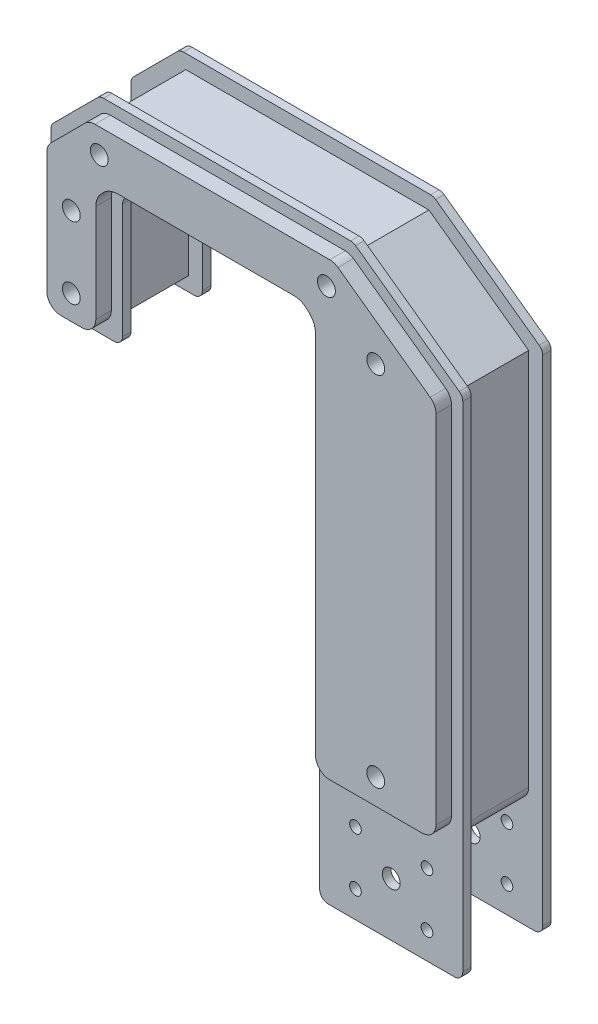
from build123d import *

# Parameters (mm, degrees)
SKETCH2_R           = 3.175
SKETCH2_R_2         = 2.07
BOSS_EXTRUDE1_DEPTH = 1.5
SKETCH3_R           = 3.175
BOSS_EXTRUDE2_DEPTH = 25.4
FILLET2_R           = 5
BOSS_EXTRUDE3_START = 26.9
SKETCH2_3_R         = 3.175
SKETCH2_3_R_2       = 2.07
BOSS_EXTRUDE3_DEPTH = 3
FILLET3_R           = 3
FILLET4_R           = 3
SKETCH5_R           = 3.175
BOSS_EXTRUDE6_DEPTH = 5.5
FILLET7_R           = 5


with BuildPart() as part:
    # Sketch2 → Boss-Extrude1 (new, symmetric)
    with BuildSketch(Plane.XY):
        Polygon((-25.4, 90), (-25.4, -90), (25.4, -90), (25.4, 90), (-13.421024484, 117.9), (-103.421024484, 117.9), (-120.8, 100.521024484), (-120.8, 45), (-95.4, 45), (-95.4, 90), (-92.9, 92.5), (-27.9, 92.5), align=None)
        with Locations((-108.1, 57.7)):
            Circle(SKETCH2_R, mode=Mode.SUBTRACT)
        with Locations((-108.1, 83.1)):
            Circle(SKETCH2_R, mode=Mode.SUBTRACT)
        with Locations((0, 90)):
            Circle(SKETCH2_R, mode=Mode.SUBTRACT)
        with Locations((0, 64.6)):
            Circle(SKETCH2_R, mode=Mode.SUBTRACT)
        with Locations((0, 39.2)):
            Circle(SKETCH2_R, mode=Mode.SUBTRACT)
        with Locations((0, 13.8)):
            Circle(SKETCH2_R, mode=Mode.SUBTRACT)
        with Locations((0, -11.6)):
            Circle(SKETCH2_R, mode=Mode.SUBTRACT)
        with Locations((0, -37)):
            Circle(SKETCH2_R, mode=Mode.SUBTRACT)
        with Locations((-57.835898506, 105.2)):
            Circle(SKETCH2_R, mode=Mode.SUBTRACT)
        with Locations((-98.160512242, 105.2)):
            Circle(SKETCH2_R, mode=Mode.SUBTRACT)
        with Locations((-17.51128477, 105.2)):
            Circle(SKETCH2_R, mode=Mode.SUBTRACT)
        with Locations((0, -70.95)):
            Circle(SKETCH2_R, mode=Mode.SUBTRACT)
        with Locations((-12.7, -61.425)):
            Circle(SKETCH2_R_2, mode=Mode.SUBTRACT)
        with Locations((12.7, -61.425)):
            Circle(SKETCH2_R_2, mode=Mode.SUBTRACT)
        with Locations((12.7, -80.475)):
            Circle(SKETCH2_R_2, mode=Mode.SUBTRACT)
        with Locations((-12.7, -80.475)):
            Circle(SKETCH2_R_2, mode=Mode.SUBTRACT)
    extrude(amount=BOSS_EXTRUDE1_DEPTH, both=True)

    # Fillet4
    fillet4_edges = [part.edges().sort_by_distance(p)[0] for p in [
        (-120.8, 100.521024484, 0),
        (-103.421024484, 117.9, 0),
        (-13.421024484, 117.9, 0),
        (25.4, 90, 0),
        (25.4, -90, 0),
        (-25.4, -90, 0),
        (-25.4, 90, 0),
        (-27.9, 92.5, 0),
        (-92.9, 92.5, 0),
        (-95.4, 90, 0),
        (-95.4, 45, 0),
        (-120.8, 45, 0),
    ]]
    fillet(fillet4_edges, radius=FILLET4_R)


with BuildPart() as body_2:
    # Sketch3 → Boss-Extrude2 (new body)
    with BuildSketch(Plane.XY.offset(1.5)):
        Polygon((-20.4, -51.9), (20.4, -51.9), (20.4, 87.436091053), (-15.031363179, 112.9), (-101.349956672, 112.9), (-115.8, 98.449956672), (-115.8, 50), (-100.4, 50), (-100.4, 92.071067812), (-94.971067812, 97.5), (-25.828932188, 97.5), (-20.4, 92.071067812), align=None)
        with Locations((0, -37)):
            Circle(SKETCH3_R, mode=Mode.SUBTRACT)
        with Locations((0, -11.6)):
            Circle(SKETCH3_R, mode=Mode.SUBTRACT)
        with Locations((0, 13.8)):
            Circle(SKETCH3_R, mode=Mode.SUBTRACT)
        with Locations((-108.1, 57.7)):
            Circle(SKETCH3_R, mode=Mode.SUBTRACT)
        with Locations((-108.1, 83.1)):
            Circle(SKETCH3_R, mode=Mode.SUBTRACT)
        with Locations((-98.160512242, 105.2)):
            Circle(SKETCH3_R, mode=Mode.SUBTRACT)
        with Locations((-57.835898506, 105.2)):
            Circle(SKETCH3_R, mode=Mode.SUBTRACT)
        with Locations((0, 39.2)):
            Circle(SKETCH3_R, mode=Mode.SUBTRACT)
        with Locations((0, 64.6)):
            Circle(SKETCH3_R, mode=Mode.SUBTRACT)
        with Locations((-17.51128477, 105.2)):
            Circle(SKETCH3_R, mode=Mode.SUBTRACT)
        with Locations((0, 90)):
            Circle(SKETCH3_R, mode=Mode.SUBTRACT)
    extrude(amount=BOSS_EXTRUDE2_DEPTH)

    # Fillet2
    fillet2_edges = [body_2.edges().sort_by_distance(p)[0] for p in [
        (20.4, -51.9, 14.2),
        (-20.4, -51.9, 14.2),
    ]]
    fillet(fillet2_edges, radius=FILLET2_R)


with BuildPart() as body_3:
    # Sketch2<3> → Boss-Extrude3 (new body)
    with BuildSketch(Plane.XY.offset(BOSS_EXTRUDE3_START)):
        Polygon((-25.4, 90), (-25.4, -90), (25.4, -90), (25.4, 90), (-13.421024484, 117.9), (-103.421024484, 117.9), (-120.8, 100.521024484), (-120.8, 45), (-95.4, 45), (-95.4, 90), (-92.9, 92.5), (-27.9, 92.5), align=None)
        with Locations((-108.1, 57.7)):
            Circle(SKETCH2_3_R, mode=Mode.SUBTRACT)
        with Locations((-108.1, 83.1)):
            Circle(SKETCH2_3_R, mode=Mode.SUBTRACT)
        with Locations((0, 90)):
            Circle(SKETCH2_3_R, mode=Mode.SUBTRACT)
        with Locations((0, 64.6)):
            Circle(SKETCH2_3_R, mode=Mode.SUBTRACT)
        with Locations((0, 39.2)):
            Circle(SKETCH2_3_R, mode=Mode.SUBTRACT)
        with Locations((0, 13.8)):
            Circle(SKETCH2_3_R, mode=Mode.SUBTRACT)
        with Locations((0, -11.6)):
            Circle(SKETCH2_3_R, mode=Mode.SUBTRACT)
        with Locations((0, -37)):
            Circle(SKETCH2_3_R, mode=Mode.SUBTRACT)
        with Locations((-57.835898506, 105.2)):
            Circle(SKETCH2_3_R, mode=Mode.SUBTRACT)
        with Locations((-98.160512242, 105.2)):
            Circle(SKETCH2_3_R, mode=Mode.SUBTRACT)
        with Locations((-17.51128477, 105.2)):
            Circle(SKETCH2_3_R, mode=Mode.SUBTRACT)
        with Locations((0, -70.95)):
            Circle(SKETCH2_3_R, mode=Mode.SUBTRACT)
        with Locations((-12.7, -61.425)):
            Circle(SKETCH2_3_R_2, mode=Mode.SUBTRACT)
        with Locations((12.7, -61.425)):
            Circle(SKETCH2_3_R_2, mode=Mode.SUBTRACT)
        with Locations((12.7, -80.475)):
            Circle(SKETCH2_3_R_2, mode=Mode.SUBTRACT)
        with Locations((-12.7, -80.475)):
            Circle(SKETCH2_3_R_2, mode=Mode.SUBTRACT)
    extrude(amount=BOSS_EXTRUDE3_DEPTH)

    # Fillet3
    fillet3_edges = [body_3.edges().sort_by_distance(p)[0] for p in [
        (-27.9, 92.5, 28.4),
        (-92.9, 92.5, 28.4),
        (-95.4, 90, 28.4),
        (-95.4, 45, 28.4),
        (-120.8, 45, 28.4),
        (-120.8, 100.521024484, 28.4),
        (-103.421024484, 117.9, 28.4),
        (-13.421024484, 117.9, 28.4),
        (25.4, 90, 28.4),
        (25.4, -90, 28.4),
        (-25.4, -90, 28.4),
        (-25.4, 90, 28.4),
    ]]
    fillet(fillet3_edges, radius=FILLET3_R)


with BuildPart() as body_4:
    # Sketch5 → Boss-Extrude6 (new body)
    with BuildSketch(Plane.XY.offset(29.9)):
        with BuildLine():
            Line((-21.4, -46), (21.4, -46))
            Line((21.4, -46), (21.4, 87.948872842))
            Line((21.4, 87.948872842), (-14.70929544, 113.9))
            Line((-14.70929544, 113.9), (-101.764170235, 113.9))
            Line((-101.764170235, 113.9), (-116.8, 98.864170235))
            Line((-116.8, 98.864170235), (-116.8, 49))
            Line((-116.8, 49), (-99.4, 49))
            Line((-99.4, 49), (-99.4, 88.757359313))
            ThreePointArc((-99.4, 88.757359313), (-98.867156728, 91.436143339), (-97.349747468, 93.707106781))
            Line((-97.349747468, 93.707106781), (-96.607106781, 94.449747468))
            ThreePointArc((-96.607106781, 94.449747468), (-94.336143339, 95.967156728), (-91.657359313, 96.5))
            Line((-91.657359313, 96.5), (-29.142640687, 96.5))
            ThreePointArc((-29.142640687, 96.5), (-26.463856661, 95.967156728), (-24.192893219, 94.449747468))
            Line((-24.192893219, 94.449747468), (-23.450252532, 93.707106781))
            ThreePointArc((-23.450252532, 93.707106781), (-21.932843272, 91.436143339), (-21.4, 88.757359313))
            Line((-21.4, 88.757359313), (-21.4, -46))
        make_face()
        with Locations((0, -37)):
            Circle(SKETCH5_R, mode=Mode.SUBTRACT)
        with Locations((0, 90)):
            Circle(SKETCH5_R, mode=Mode.SUBTRACT)
        with Locations((-17.51128477, 105.2)):
            Circle(SKETCH5_R, mode=Mode.SUBTRACT)
        with Locations((-98.160512242, 105.2)):
            Circle(SKETCH5_R, mode=Mode.SUBTRACT)
        with Locations((-108.1, 83.1)):
            Circle(SKETCH5_R, mode=Mode.SUBTRACT)
        with Locations((-108.1, 57.7)):
            Circle(SKETCH5_R, mode=Mode.SUBTRACT)
    extrude(amount=BOSS_EXTRUDE6_DEPTH)

    # Fillet7
    fillet7_edges = [body_4.edges().sort_by_distance(p)[0] for p in [
        (-99.4, 49, 32.65),
        (-116.8, 49, 32.65),
        (-116.8, 98.864170235, 32.65),
        (-101.764170235, 113.9, 32.65),
        (-14.70929544, 113.9, 32.65),
        (21.4, 87.948872842, 32.65),
        (21.4, -46, 32.65),
        (-21.4, -46, 32.65),
    ]]
    fillet(fillet7_edges, radius=FILLET7_R)


solid = Compound([part.part, body_2.part, body_3.part, body_4.part])
